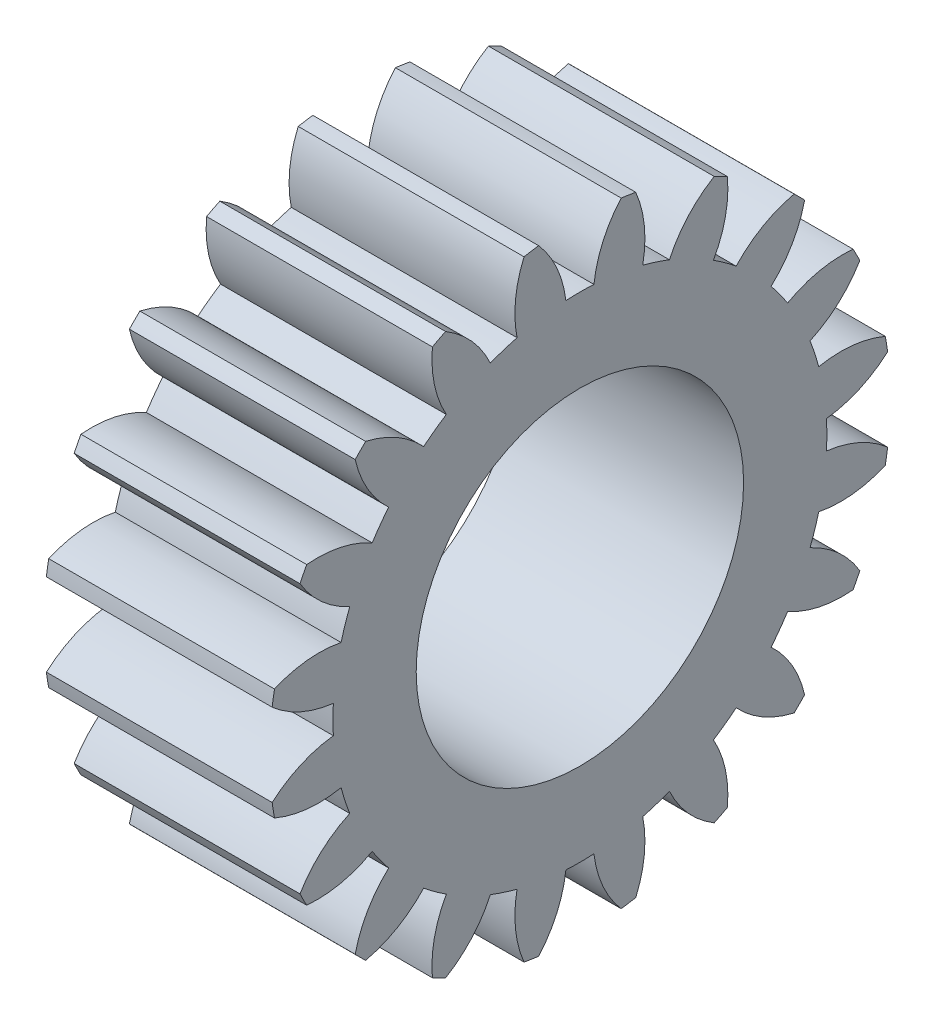
from build123d import *

# Parameters (mm, degrees)
BASPROSKE_W        = 10
BASPROSKE_H        = 13.75
TOOTHCUT_DEPTH     = 22.866069606
TEETHCUTS_COUNT    = 20
TEETHCUTS_ANGLE    = 342
BORSKE_R           = 7
BORE_DEPTH         = 50.0000508
SKETCH2_R          = 7.25
CUT_EXTRUDE1_DEPTH = 10


with BuildPart() as part:
    # BasProSke → Base-Revolve (revolve)
    with BuildSketch(Plane(origin=(0, 0, 0), x_dir=(1, 0, 0), z_dir=(0, 1, 0)), mode=Mode.PRIVATE) as base_revolve_sk:
        with Locations((5, 6.875)):
            Rectangle(BASPROSKE_W, BASPROSKE_H)
    revolve(base_revolve_sk.sketch.rotate(Axis((-10, 0, 0), (1, 0, 0)), 180), axis=Axis((-10, 0, 0), (1, 0, 0)))

    # TooCutSke → ToothCut (cut, through all)
    with BuildSketch(Plane(origin=(0, 0, 0), x_dir=(0, 0, -1), z_dir=(1, 0, 0))):
        with BuildLine():
            ThreePointArc((0.62110296, 10.918848994), (0, 10.9365), (-0.62110296, 10.918848994))
            ThreePointArc((-0.62110296, 10.918848994), (-1.024517052, 12.378857135), (-1.846615859, 13.651067908))
            ThreePointArc((-1.846615859, 13.651067908), (0, 13.7754), (1.846615859, 13.651067908))
            ThreePointArc((1.846615859, 13.651067908), (1.024517052, 12.378857135), (0.62110296, 10.918848994))
        make_face()
    toothcut = extrude(amount=TOOTHCUT_DEPTH, mode=Mode.SUBTRACT)

    # TeethCuts: ToothCut ×20 about axis
    teethcuts_axis = Axis((-10, 0, 0), (1, 0, 0))
    for i in range(1, TEETHCUTS_COUNT):
        add(toothcut.rotate(teethcuts_axis, i * TEETHCUTS_ANGLE / (TEETHCUTS_COUNT - 1)), mode=Mode.SUBTRACT)

    # BorSke → Bore (cut, symmetric)
    with BuildSketch(Plane(origin=(0, 0, 0), x_dir=(0, 0, -1), z_dir=(1, 0, 0))):
        with Locations(Location((0, 0, 0), (0, 0, 180))):
            Circle(BORSKE_R)
    extrude(amount=BORE_DEPTH, both=True, mode=Mode.SUBTRACT)

    # Sketch2 → Cut-Extrude1 (cut)
    with BuildSketch(Plane(origin=(10, 0, 0), x_dir=(0, 0, -1), z_dir=(1, 0, 0))):
        Circle(SKETCH2_R)
    extrude(amount=-CUT_EXTRUDE1_DEPTH, mode=Mode.SUBTRACT)


solid = part.part
